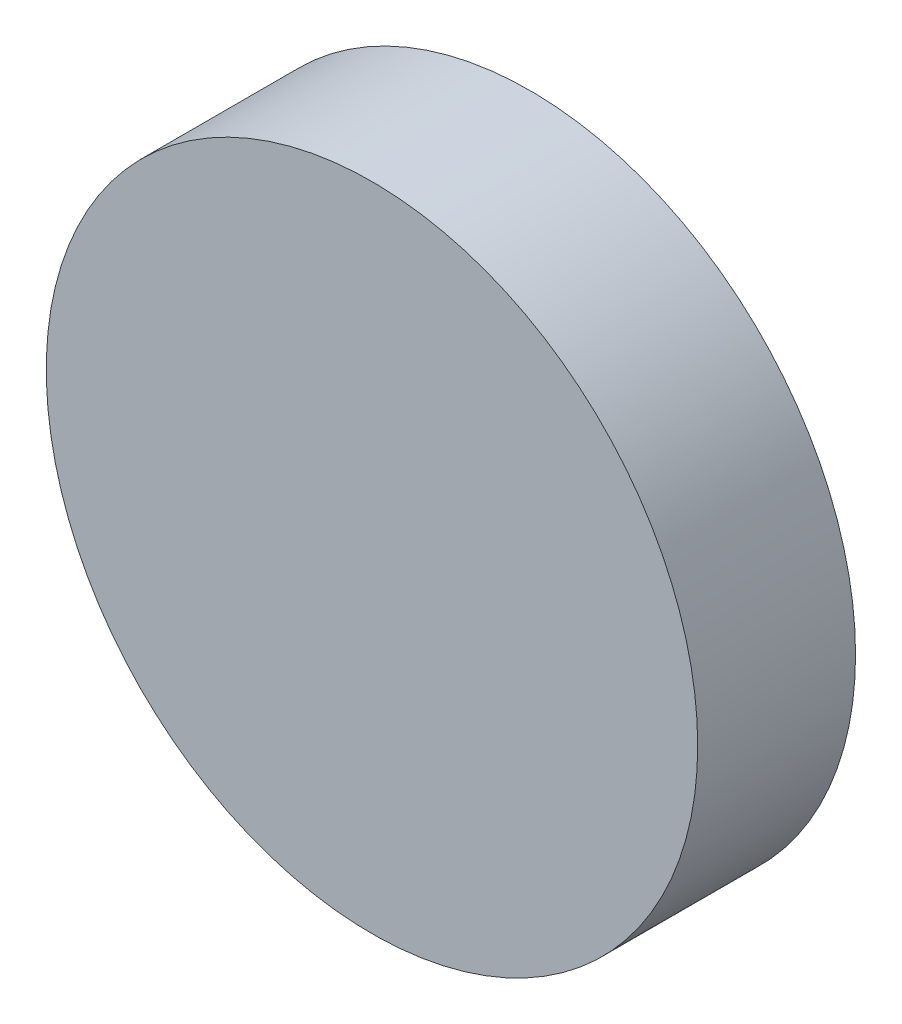
from build123d import *

# Parameters (mm, degrees)
ESQUISSE1_R        = 41.275
BOSS_EXTRU_1_DEPTH = 20


with BuildPart() as part:
    # Esquisse1 → Boss.-Extru.1 (new body)
    with BuildSketch(Plane.XY):
        with Locations((41.5, 31.275)):
            Circle(ESQUISSE1_R)
    extrude(amount=BOSS_EXTRU_1_DEPTH)


solid = part.part
